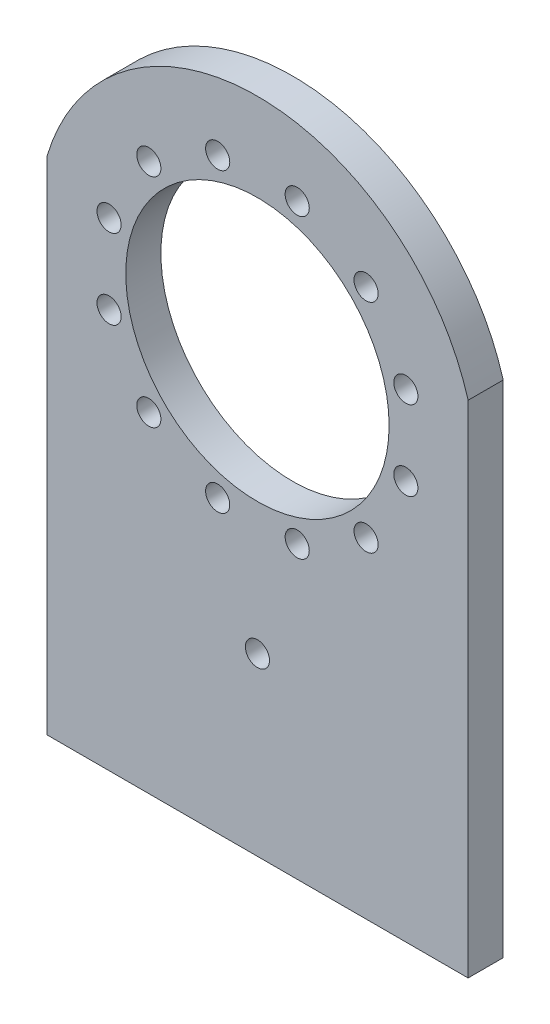
from build123d import *

# Parameters (mm, degrees)
SKETCH_1_R          = 30
EXTRUDE_1_DEPTH     = 8
SKETCH_2_R          = 2.75
CUT_EXTRUDE_1_DEPTH = 50
SKETCH_3_R          = 2.75
CUT_EXTRUDE_2_DEPTH = 20
SKETCH_4_R          = 2.75
CUT_EXTRUDE_3_DEPTH = 10


with BuildPart() as part:
    # 草图1 → 凸台-拉伸1 (new body)
    with BuildSketch(Plane.XY):
        with BuildLine():
            Line((-48, 114), (-48, 0))
            Line((-48, 0), (48, 0))
            Line((48, 0), (48, 114))
            ThreePointArc((48, 114), (0, 150), (-48, 114))
        make_face()
        with Locations((0, 100)):
            Circle(SKETCH_1_R, mode=Mode.SUBTRACT)
    extrude(amount=EXTRUDE_1_DEPTH)

    # 草图2 → 切除-拉伸1 (cut)
    with BuildSketch(Plane.XZ):
        with Locations(Location((35, 4, 0), (0, 0, 270))):
            Circle(SKETCH_2_R)
        with Locations(Location((-35, 4, 0), (0, 0, 270))):
            Circle(SKETCH_2_R)
    extrude(amount=-CUT_EXTRUDE_1_DEPTH, mode=Mode.SUBTRACT)

    # 草图3 → 切除-拉伸2 (cut)
    with BuildSketch(Plane.XY.offset(8)):
        with Locations((0, 40)):
            Circle(SKETCH_3_R)
    extrude(amount=-CUT_EXTRUDE_2_DEPTH, mode=Mode.SUBTRACT)

    # 草图4 → 切除-拉伸3 (cut)
    with BuildSketch(Plane.XY.offset(8)):
        with Locations((9.058666579, 133.80740392)):
            Circle(SKETCH_4_R)
        with Locations((24.748737342, 124.748737342)):
            Circle(SKETCH_4_R)
        with Locations((33.80740392, 109.058666579)):
            Circle(SKETCH_4_R)
        with Locations((33.80740392, 90.941333421)):
            Circle(SKETCH_4_R)
        with Locations((24.748737342, 75.251262658)):
            Circle(SKETCH_4_R)
        with Locations((9.058666579, 66.19259608)):
            Circle(SKETCH_4_R)
        with Locations((-9.058666579, 66.19259608)):
            Circle(SKETCH_4_R)
        with Locations((-24.748737342, 75.251262658)):
            Circle(SKETCH_4_R)
        with Locations((-33.80740392, 90.941333421)):
            Circle(SKETCH_4_R)
        with Locations((-33.80740392, 109.058666579)):
            Circle(SKETCH_4_R)
        with Locations((-24.748737342, 124.748737342)):
            Circle(SKETCH_4_R)
        with Locations((-9.058666579, 133.80740392)):
            Circle(SKETCH_4_R)
    extrude(amount=-CUT_EXTRUDE_3_DEPTH, mode=Mode.SUBTRACT)


solid = part.part
